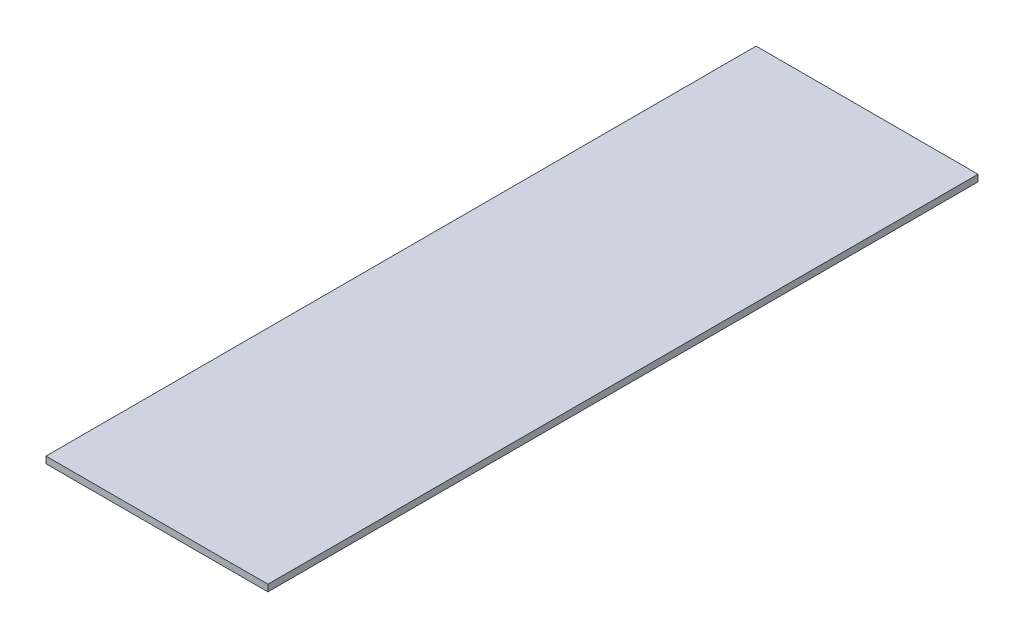
from build123d import *

# Parameters (mm, degrees)
SKETCH1_W   = 100
SKETCH1_H   = 320
SIDES_DEPTH = 3


with BuildPart() as part:
    # Sketch1 → Sides (new body)
    with BuildSketch(Plane(origin=(0, 0, 0), x_dir=(1, 0, 0), z_dir=(0, 1, 0))):
        Rectangle(SKETCH1_W, SKETCH1_H)
    extrude(amount=SIDES_DEPTH)


solid = part.part
